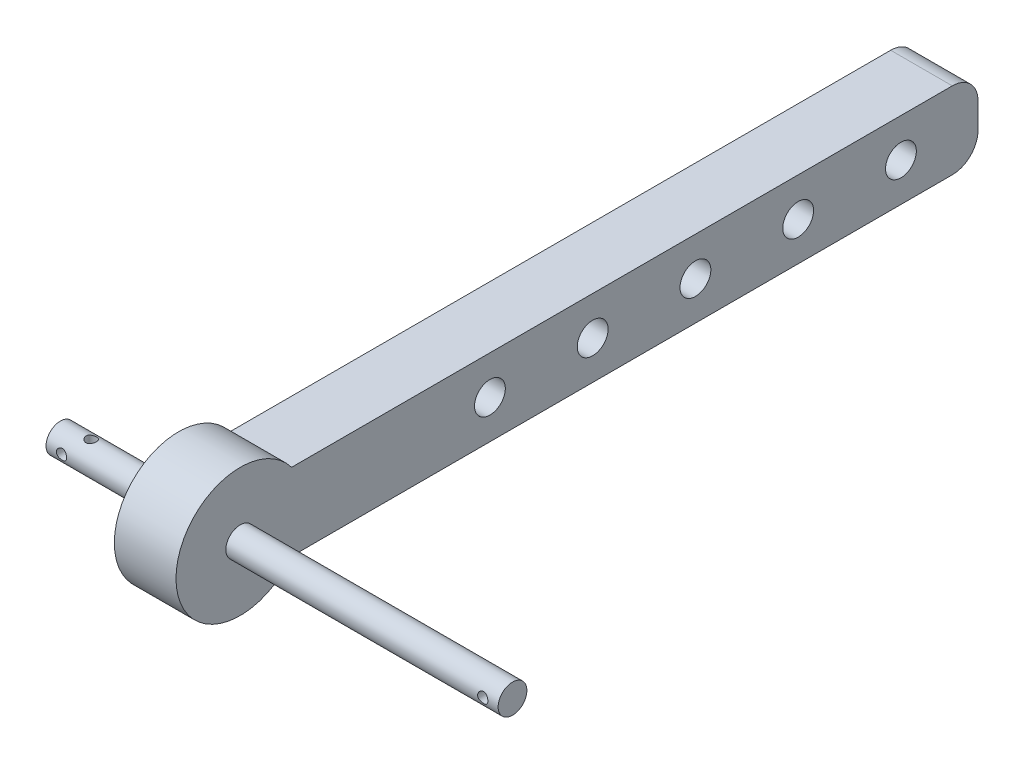
from build123d import *

# Parameters (mm, degrees)
SKETCH_1_W           = 150
SKETCH_1_H           = 15
EXTRUDE_1_DEPTH      = 12
FILLET_1_R           = 5
SKETCH_6_R           = 12.5
EXTRUDE_2_DEPTH      = 12
EXTRUDE_5_DEPTH      = 23
EXTRUDE_5_DEPTH_BACK = 65
SKETCH_15_R          = 2.8
CUT_EXTRUDE_9_REACH  = 166.697
SKETCH_16_R          = 1
CUT_EXTRUDE_10_REACH = 166.697
SKETCH_17_R          = 3
SKETCH_18_R          = 1
CUT_EXTRUDE_11_DEPTH = 15


with BuildPart() as part:
    # 草图1 → 凸台-拉伸1 (new body)
    with BuildSketch(Plane(origin=(0, 0, 0), x_dir=(0, 0, -1), z_dir=(1, 0, 0))):
        with Locations((75, 7.5)):
            Rectangle(SKETCH_1_W, SKETCH_1_H)
    extrude(amount=EXTRUDE_1_DEPTH)

    # 圆角1
    fillet_1_edges = [part.edges().sort_by_distance(p)[0] for p in [
        (6, 15, 0),
        (6, 15, -150),
        (6, 0, -150),
        (6, 0, 0),
    ]]
    fillet(fillet_1_edges, radius=FILLET_1_R)

    # 草图6 → 凸台-拉伸2 (add)
    with BuildSketch(Plane(origin=(12, 0, 0), x_dir=(0, 0, -1), z_dir=(1, 0, 0))):
        with Locations((6.4, 7.5)):
            Circle(SKETCH_6_R)
    extrude(amount=-EXTRUDE_2_DEPTH)

    # 草图15 → 凸台-拉伸5 (add, two sides: drawn at the far end of the back side and taken through both)
    with BuildSketch(Plane.ZY.offset(-EXTRUDE_5_DEPTH_BACK)):
        with Locations((-6.4, 7.5)):
            Circle(SKETCH_15_R)
    extrude(amount=EXTRUDE_5_DEPTH + EXTRUDE_5_DEPTH_BACK)

    # 草图16 → 切除-拉伸9 (cut, up to next)
    with BuildSketch(Plane.XY, mode=Mode.PRIVATE) as cut_extrude_9_sk1:
        with Locations((-20, 7.5)):
            Circle(SKETCH_16_R)
    cut_extrude_9_tool1 = extrude(cut_extrude_9_sk1.sketch, amount=-CUT_EXTRUDE_9_REACH, mode=Mode.PRIVATE) & part.part
    # 草图16 → 切除-拉伸9 (cut, up to next)
    with BuildSketch(Plane.XY, mode=Mode.PRIVATE) as cut_extrude_9_sk2:
        with Locations((62, 7.5)):
            Circle(SKETCH_16_R)
    cut_extrude_9_tool2 = extrude(cut_extrude_9_sk2.sketch, amount=-CUT_EXTRUDE_9_REACH, mode=Mode.PRIVATE) & part.part
    add(cut_extrude_9_tool1.solids().sort_by_distance((-20, 7.5, 0))[0], mode=Mode.SUBTRACT)
    add(cut_extrude_9_tool2.solids().sort_by_distance((62, 7.5, 0))[0], mode=Mode.SUBTRACT)

    # 草图17 → 切除-拉伸10 (cut, up to next)
    with BuildSketch(Plane.ZY, mode=Mode.PRIVATE) as cut_extrude_10_sk1:
        with Locations((-135, 7.5)):
            Circle(SKETCH_17_R)
    cut_extrude_10_tool1 = extrude(cut_extrude_10_sk1.sketch, amount=-CUT_EXTRUDE_10_REACH, mode=Mode.PRIVATE) & part.part
    # 草图17 → 切除-拉伸10 (cut, up to next)
    with BuildSketch(Plane.ZY, mode=Mode.PRIVATE) as cut_extrude_10_sk2:
        with Locations((-115, 7.5)):
            Circle(SKETCH_17_R)
    cut_extrude_10_tool2 = extrude(cut_extrude_10_sk2.sketch, amount=-CUT_EXTRUDE_10_REACH, mode=Mode.PRIVATE) & part.part
    # 草图17 → 切除-拉伸10 (cut, up to next)
    with BuildSketch(Plane.ZY, mode=Mode.PRIVATE) as cut_extrude_10_sk3:
        with Locations((-95, 7.5)):
            Circle(SKETCH_17_R)
    cut_extrude_10_tool3 = extrude(cut_extrude_10_sk3.sketch, amount=-CUT_EXTRUDE_10_REACH, mode=Mode.PRIVATE) & part.part
    # 草图17 → 切除-拉伸10 (cut, up to next)
    with BuildSketch(Plane.ZY, mode=Mode.PRIVATE) as cut_extrude_10_sk4:
        with Locations((-75, 7.5)):
            Circle(SKETCH_17_R)
    cut_extrude_10_tool4 = extrude(cut_extrude_10_sk4.sketch, amount=-CUT_EXTRUDE_10_REACH, mode=Mode.PRIVATE) & part.part
    # 草图17 → 切除-拉伸10 (cut, up to next)
    with BuildSketch(Plane.ZY, mode=Mode.PRIVATE) as cut_extrude_10_sk5:
        with Locations((-55, 7.5)):
            Circle(SKETCH_17_R)
    cut_extrude_10_tool5 = extrude(cut_extrude_10_sk5.sketch, amount=-CUT_EXTRUDE_10_REACH, mode=Mode.PRIVATE) & part.part
    add(cut_extrude_10_tool1.solids().sort_by_distance((0, 7.5, -135))[0], mode=Mode.SUBTRACT)
    add(cut_extrude_10_tool2.solids().sort_by_distance((0, 7.5, -115))[0], mode=Mode.SUBTRACT)
    add(cut_extrude_10_tool3.solids().sort_by_distance((0, 7.5, -95))[0], mode=Mode.SUBTRACT)
    add(cut_extrude_10_tool4.solids().sort_by_distance((0, 7.5, -75))[0], mode=Mode.SUBTRACT)
    add(cut_extrude_10_tool5.solids().sort_by_distance((0, 7.5, -55))[0], mode=Mode.SUBTRACT)

    # 草图18 → 切除-拉伸11 (cut)
    with BuildSketch(Plane(origin=(0, 0, 0), x_dir=(1, 0, 0), z_dir=(0, 1, 0))):
        with Locations(Location((-17, 6.4, 0), (0, 0, 90))):
            Circle(SKETCH_18_R)
    extrude(amount=CUT_EXTRUDE_11_DEPTH, mode=Mode.SUBTRACT)


solid = part.part
